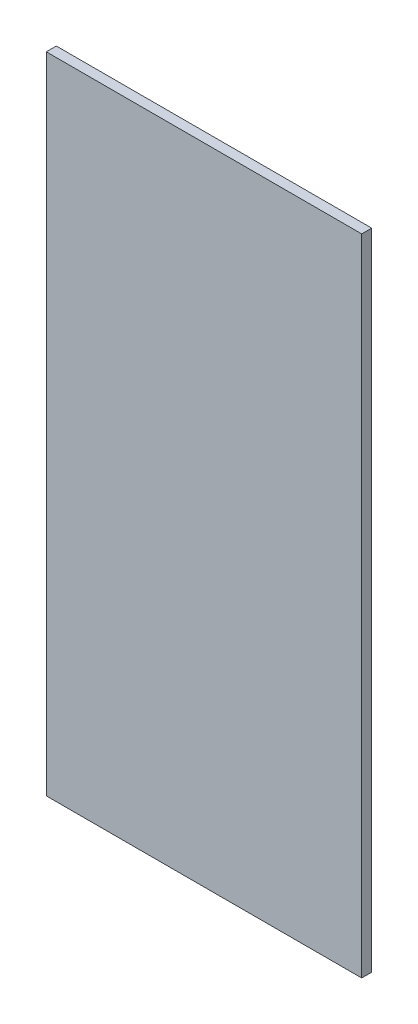
from build123d import *

# Parameters (mm, degrees)
SZKIC1_W                    = 220.27
SZKIC1_H                    = 450
DODANIE_WYCI_GNI_CIE1_DEPTH = 7


with BuildPart() as part:
    # Szkic1 → Dodanie-wyciągnięcie1 (new body)
    with BuildSketch(Plane.XY):
        with Locations((110.135, 225)):
            Rectangle(SZKIC1_W, SZKIC1_H)
    extrude(amount=DODANIE_WYCI_GNI_CIE1_DEPTH)


solid = part.part
